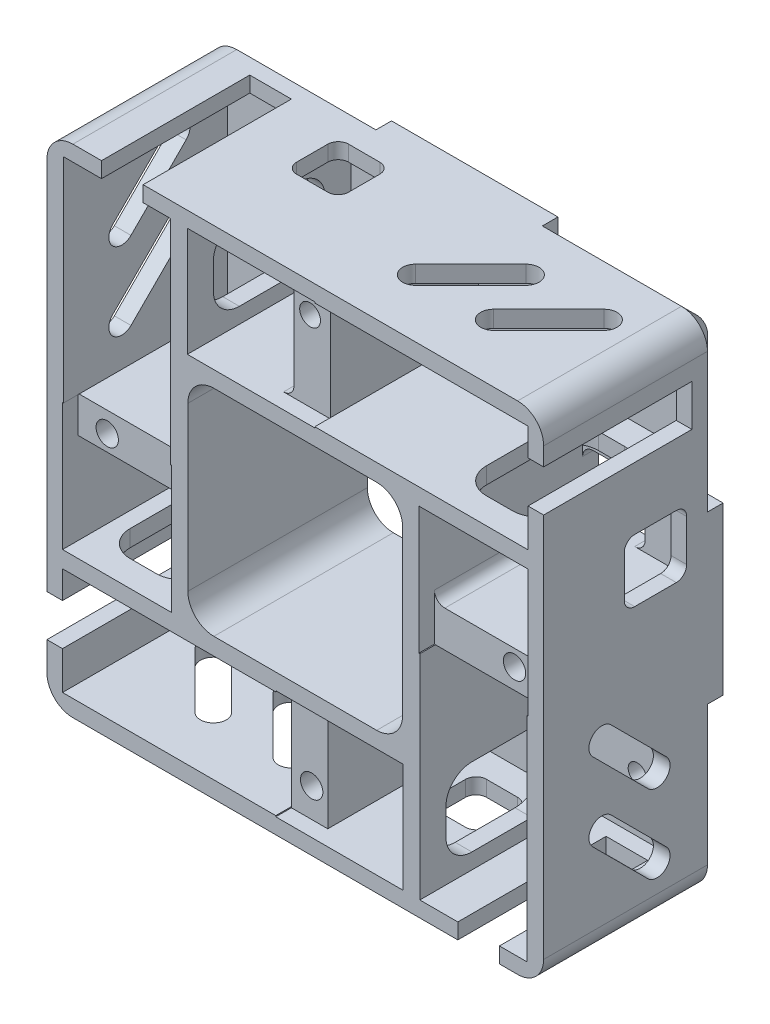
from build123d import *

# Parameters (mm, degrees)
SKETCH_1_W                       = 95.5
SKETCH_1_H                       = 95.5
SKETCH_1_R                       = 1.75
EXTRUDE_1_DEPTH                  = 3
SKETCH_3_W                       = 95.5
SKETCH_3_H                       = 95.5
SKETCH_3_W_2                     = 41
SKETCH_3_H_2                     = 21
SKETCH_3_W_3                     = 21
SKETCH_3_H_3                     = 18.5
SKETCH_3_W_4                     = 18.5
SKETCH_3_H_4                     = 41
EXTRUDE_2_DEPTH                  = 31.5
FILLET_1_R                       = 5
CHAMFER_1_SIZE                   = 3
SKETCH_17_W                      = 32
SKETCH_17_H                      = 3
SKETCH_17_W_2                    = 3
SKETCH_17_H_2                    = 32
EXTRUDE_6_DEPTH                  = 3
SKETCH_19_R                      = 2
CUT_EXTRUDE_4_DEPTH              = 2.8
SKETCH_21_W                      = 21
SKETCH_21_H                      = 6
SKETCH_21_W_2                    = 6
SKETCH_21_H_2                    = 21
CUT_EXTRUDE_6_DEPTH              = 3
SKETCH_34_W                      = 28.5
SKETCH_34_H                      = 21
EXTRUDE_8_DEPTH                  = 1
SKETCH_35_W                      = 21
SKETCH_35_H                      = 28.5
EXTRUDE_9_DEPTH                  = 1
SKETCH_36_W                      = 28.5
SKETCH_36_H                      = 21
EXTRUDE_10_DEPTH                 = 1
SKETCH_37_W                      = 21
SKETCH_37_H                      = 28.5
EXTRUDE_11_DEPTH                 = 1
SKETCH_20_R                      = 2.15
SKETCH_20_R_2                    = 2
CUT_EXTRUDE_5_DEPTH              = 5
CUT_EXTRUDE_START                = 3
SKETCH_23_W                      = 8
SKETCH_23_H                      = 3
SKETCH_23_W_2                    = 3
SKETCH_23_H_2                    = 8
CUT_EXTRUDE_8_DEPTH              = 72.51426038
SKETCH_24_W                      = 10
SKETCH_24_H                      = 10
CUT_EXTRUDE_9_DEPTH              = 10
SKETCH_25_W                      = 12
SKETCH_25_H                      = 12
CUT_EXTRUDE_10_DEPTH             = 10
SKETCH_26_W                      = 10
SKETCH_26_H                      = 10
CUT_EXTRUDE_11_DEPTH             = 10
SKETCH_27_W                      = 10
SKETCH_27_H                      = 10
CUT_EXTRUDE_12_DEPTH             = 10
CUT_EXTRUDE_13_DEPTH             = 75.51426038
CUT_EXTRUDE_13_DEPTH_BACK        = 75.51426038
SKETCH_28_W                      = 12
SKETCH_28_H                      = 12
FILLET_2_R                       = 2
FILLET_3_R                       = 2
SKETCH_38_W                      = 0.2
SKETCH_38_H                      = 41
SKETCH_38_W_2                    = 41
SKETCH_38_H_2                    = 0.2
EXTRUDE_12_DEPTH                 = 31.5
SKETCH_40_W                      = 41.5
SKETCH_40_H                      = 41.5
EXTRUDE_13_DEPTH                 = 31.5
SKETCH_39_W                      = 41.3
SKETCH_39_H                      = 41.3
CUT_EXTRUDE_14_DEPTH             = 76.831227077
FILLET_4_R                       = 5
CUT_EXTRUDE_15_DEPTH             = 10
PATTERN_CIRCULAR_1_COUNT         = 4
SKETCH_45_W                      = 21.5
SKETCH_45_H                      = 15
CUT_EXTRUDE_16_DEPTH             = 10
FILLET_5_R                       = 5
PATTERN_CIRCULAR_2_COUNT         = 4
FILLET_5_OF_PATTERN_CIRCULAR_2_R = 5


with BuildPart() as part:
    # ｽｹｯﾁ1 → ﾎﾞｽ - 押し出し1 (new body)
    with BuildSketch(Plane.XY):
        Rectangle(SKETCH_1_W, SKETCH_1_H)
        with Locations((34.25, 34.25)):
            Circle(SKETCH_1_R, mode=Mode.SUBTRACT)
        with Locations((-34.25, 34.25)):
            Circle(SKETCH_1_R, mode=Mode.SUBTRACT)
        with Locations((-34.25, -34.25)):
            Circle(SKETCH_1_R, mode=Mode.SUBTRACT)
        with Locations((34.25, -34.25)):
            Circle(SKETCH_1_R, mode=Mode.SUBTRACT)
    extrude(amount=EXTRUDE_1_DEPTH)

    # ｽｹｯﾁ3 → ﾎﾞｽ - 押し出し2 (add)
    with BuildSketch(Plane.XY.offset(3)):
        Rectangle(SKETCH_3_W, SKETCH_3_H)
        with Locations((-24.25, -34.25)):
            Rectangle(SKETCH_3_W_2, SKETCH_3_H_2, mode=Mode.SUBTRACT)
        with Locations((-34.25, -11.5)):
            Rectangle(SKETCH_3_W_3, SKETCH_3_H_3, mode=Mode.SUBTRACT)
        with Locations((11.5, -34.25)):
            Rectangle(SKETCH_3_W_4, SKETCH_3_H_2, mode=Mode.SUBTRACT)
        with Locations((34.25, -24.25)):
            Rectangle(SKETCH_3_W_3, SKETCH_3_H_4, mode=Mode.SUBTRACT)
        with Locations((-34.25, 24.25)):
            Rectangle(SKETCH_3_W_3, SKETCH_3_H_4, mode=Mode.SUBTRACT)
        with Locations((-11.5, 34.25)):
            Rectangle(SKETCH_3_W_4, SKETCH_3_H_2, mode=Mode.SUBTRACT)
        Polygon((20.75, -20.75), (2.25, -20.75), (-20.75, -20.75), (-20.75, -2), (-20.75, 20.75), (-2, 20.75), (20.75, 20.75), (20.75, 2), align=None, mode=Mode.SUBTRACT)
        with Locations((34.25, 11.5)):
            Rectangle(SKETCH_3_W_3, SKETCH_3_H_3, mode=Mode.SUBTRACT)
        with Locations((24.25, 34.25)):
            Rectangle(SKETCH_3_W_2, SKETCH_3_H_2, mode=Mode.SUBTRACT)
    extrude(amount=EXTRUDE_2_DEPTH)

    # ﾌｨﾚｯﾄ1
    fillet_1_edges = [part.edges().sort_by_distance(p)[0] for p in [
        (-47.75, 47.75, 17.25),
        (47.75, 47.75, 17.25),
        (47.75, -47.75, 17.25),
        (-47.75, -47.75, 17.25),
    ]]
    fillet(fillet_1_edges, radius=FILLET_1_R)

    # 面取り1
    chamfer_1_edges = [part.edges().sort_by_distance(p)[0] for p in [
        (0, -47.75, 0),
        (-47.75, 0, 0),
        (0, 47.75, 0),
        (47.75, 0, 0),
        (-46.285533906, 46.285533906, 0),
        (46.285533906, 46.285533906, 0),
        (46.285533906, -46.285533906, 0),
        (-46.285533906, -46.285533906, 0),
    ]]
    chamfer(chamfer_1_edges, length=CHAMFER_1_SIZE)

    # ｽｹｯﾁ17 → ﾎﾞｽ - 押し出し6 (add)
    with BuildSketch(Plane(origin=(0, 0, 0), x_dir=(-1, 0, 0), z_dir=(0, 0, -1))):
        with Locations((0, 46.25)):
            Rectangle(SKETCH_17_W, SKETCH_17_H)
        with Locations((46.25, 0)):
            Rectangle(SKETCH_17_W_2, SKETCH_17_H_2)
        with Locations((0, -46.25)):
            Rectangle(SKETCH_17_W, SKETCH_17_H)
        with Locations((-46.25, 0)):
            Rectangle(SKETCH_17_W_2, SKETCH_17_H_2)
    extrude(amount=-EXTRUDE_6_DEPTH)

    # ｽｹｯﾁ19 → ｶｯﾄ - 押し出し4 (cut)
    with BuildSketch(Plane(origin=(0, 0, 0), x_dir=(-1, 0, 0), z_dir=(0, 0, -1))):
        with Locations((0, 37.75)):
            Circle(SKETCH_19_R)
        with Locations((-37.75, 0)):
            Circle(SKETCH_19_R)
        with Locations((37.75, 0)):
            Circle(SKETCH_19_R)
        with Locations((0, -37.75)):
            Circle(SKETCH_19_R)
    extrude(amount=-CUT_EXTRUDE_4_DEPTH, mode=Mode.SUBTRACT)

    # ｽｹｯﾁ21 → ｶｯﾄ - 押し出し6 (cut)
    with BuildSketch(Plane.XY.offset(34.5)):
        with Locations((34.25, -0.75)):
            Rectangle(SKETCH_21_W, SKETCH_21_H)
        with Locations((-0.75, -34.25)):
            Rectangle(SKETCH_21_W_2, SKETCH_21_H_2)
        with Locations((-34.25, 0.75)):
            Rectangle(SKETCH_21_W, SKETCH_21_H)
        with Locations((0.75, 34.25)):
            Rectangle(SKETCH_21_W_2, SKETCH_21_H_2)
    extrude(amount=-CUT_EXTRUDE_6_DEPTH, mode=Mode.SUBTRACT)

    # ｽｹｯﾁ34 → ﾎﾞｽ - 押し出し8 (add)
    with BuildSketch(Plane(origin=(2.25, 0, 0), x_dir=(0, 0, -1), z_dir=(1, 0, 0))):
        with Locations((-17.25, -34.25)):
            Rectangle(SKETCH_34_W, SKETCH_34_H)
    extrude(amount=EXTRUDE_8_DEPTH)

    # ｽｹｯﾁ35 → ﾎﾞｽ - 押し出し9 (add)
    with BuildSketch(Plane(origin=(0, -2.25, 0), x_dir=(-1, 0, 0), z_dir=(0, -1, 0))):
        with Locations((34.25, -17.25)):
            Rectangle(SKETCH_35_W, SKETCH_35_H)
    extrude(amount=EXTRUDE_9_DEPTH)

    # ｽｹｯﾁ36 → ﾎﾞｽ - 押し出し10 (add)
    with BuildSketch(Plane.ZY.offset(2.25)):
        with Locations((17.25, 34.25)):
            Rectangle(SKETCH_36_W, SKETCH_36_H)
    extrude(amount=EXTRUDE_10_DEPTH)

    # ｽｹｯﾁ37 → ﾎﾞｽ - 押し出し11 (add)
    with BuildSketch(Plane(origin=(0, 2.25, 0), x_dir=(1, 0, 0), z_dir=(0, 1, 0))):
        with Locations((34.25, -17.25)):
            Rectangle(SKETCH_37_W, SKETCH_37_H)
    extrude(amount=EXTRUDE_11_DEPTH)

    # ｽｹｯﾁ20 → ｶｯﾄ - 押し出し5 (cut)
    with BuildSketch(Plane.XY.offset(31.5)):
        with Locations((-39.15, -0.15)):
            Circle(SKETCH_20_R)
        with Locations((-0.15, 39.15)):
            Circle(SKETCH_20_R_2)
        with Locations((39.15, 0.15)):
            Circle(SKETCH_20_R)
        with Locations((0.15, -39.15)):
            Circle(SKETCH_20_R)
    extrude(amount=-CUT_EXTRUDE_5_DEPTH, mode=Mode.SUBTRACT)

    # ｽｹｯﾁ23 → ｶｯﾄ - 押し出し8 (cut, through all)
    with BuildSketch(Plane.XY.offset(3).offset(CUT_EXTRUDE_START)):
        with Locations((-33.25, 46.25)):
            Rectangle(SKETCH_23_W, SKETCH_23_H)
        with Locations((46.25, 35.25)):
            Rectangle(SKETCH_23_W_2, SKETCH_23_H_2)
        with Locations((35.25, -46.25)):
            Rectangle(SKETCH_23_W, SKETCH_23_H)
        with Locations((-46.25, -33.25)):
            Rectangle(SKETCH_23_W_2, SKETCH_23_H_2)
    extrude(amount=CUT_EXTRUDE_8_DEPTH, mode=Mode.SUBTRACT)

    # ｽｹｯﾁ24 → ｶｯﾄ - 押し出し9 (cut)
    with BuildSketch(Plane(origin=(0, 47.75, 0), x_dir=(1, 0, 0), z_dir=(0, 1, 0))):
        with Locations((-13.25, -13)):
            Rectangle(SKETCH_24_W, SKETCH_24_H)
    extrude(amount=-CUT_EXTRUDE_9_DEPTH, mode=Mode.SUBTRACT)

    # ｽｹｯﾁ25 → ｶｯﾄ - 押し出し10 (cut)
    with BuildSketch(Plane(origin=(47.75, 0, 0), x_dir=(0, 0, -1), z_dir=(1, 0, 0))):
        with Locations((-13, 13.25)):
            Rectangle(SKETCH_25_W, SKETCH_25_H)
    extrude(amount=-CUT_EXTRUDE_10_DEPTH, mode=Mode.SUBTRACT)

    # ｽｹｯﾁ26 → ｶｯﾄ - 押し出し11 (cut)
    with BuildSketch(Plane(origin=(0, -47.75, 0), x_dir=(-1, 0, 0), z_dir=(0, -1, 0))):
        with Locations((-13.25, -13)):
            Rectangle(SKETCH_26_W, SKETCH_26_H)
    extrude(amount=-CUT_EXTRUDE_11_DEPTH, mode=Mode.SUBTRACT)

    # ｽｹｯﾁ27 → ｶｯﾄ - 押し出し12 (cut)
    with BuildSketch(Plane.ZY.offset(47.75)):
        with Locations((13, -11.25)):
            Rectangle(SKETCH_27_W, SKETCH_27_H)
    extrude(amount=-CUT_EXTRUDE_12_DEPTH, mode=Mode.SUBTRACT)

    # ｽｹｯﾁ28 → ｶｯﾄ - 押し出し13 (cut, two sides: drawn at the far end of the back side and taken through both)
    with BuildSketch(Plane.XY.offset(3).offset(-CUT_EXTRUDE_13_DEPTH_BACK)):
        with Locations((29.75, 9.25)):
            Rectangle(SKETCH_28_W, SKETCH_28_H)
        with Locations((-9.25, 29.75)):
            Rectangle(SKETCH_28_W, SKETCH_28_H)
        with Locations((-29.75, -9.25)):
            Rectangle(SKETCH_28_W, SKETCH_28_H)
        with Locations((9.25, -29.75)):
            Rectangle(SKETCH_28_W, SKETCH_28_H)
    extrude(amount=CUT_EXTRUDE_13_DEPTH + CUT_EXTRUDE_13_DEPTH_BACK, mode=Mode.SUBTRACT)

    # ﾌｨﾚｯﾄ2
    fillet_2_edges = [part.edges().sort_by_distance(p)[0] for p in [
        (3.25, -23.75, 15.75),
        (-23.75, -3.25, 15.75),
        (-3.25, 23.75, 15.75),
        (23.75, 3.25, 15.75),
        (35.75, 15.25, 1.5),
        (35.75, 3.25, 1.5),
        (23.75, 15.25, 1.5),
        (-3.25, 35.75, 1.5),
        (-15.25, 23.75, 1.5),
        (-15.25, 35.75, 1.5),
        (-35.75, -15.25, 1.5),
        (-35.75, -3.25, 1.5),
        (-23.75, -15.25, 1.5),
        (3.25, -35.75, 1.5),
        (15.25, -23.75, 1.5),
        (15.25, -35.75, 1.5),
    ]]
    fillet(fillet_2_edges, radius=FILLET_2_R)

    # ﾌｨﾚｯﾄ3
    fillet_3_edges = [part.edges().sort_by_distance(p)[0] for p in [
        (-8.25, 46.25, 8),
        (-8.25, 46.25, 18),
        (-18.25, 46.25, 18),
        (-18.25, 46.25, 8),
        (46.25, 7.25, 19),
        (46.25, 19.25, 19),
        (46.25, 19.25, 7),
        (46.25, 7.25, 7),
        (18.25, -46.25, 18),
        (18.25, -46.25, 8),
        (8.25, -46.25, 8),
        (8.25, -46.25, 18),
        (-46.25, -6.25, 18),
        (-46.25, -16.25, 18),
        (-46.25, -16.25, 8),
        (-46.25, -6.25, 8),
    ]]
    fillet(fillet_3_edges, radius=FILLET_3_R)

    # ｽｹｯﾁ38 → ﾎﾞｽ - 押し出し12 (add)
    with BuildSketch(Plane.XY.offset(34.5)):
        with Locations((44.65, -24.25)):
            Rectangle(SKETCH_38_W, SKETCH_38_H)
        with Locations((23.85, -24.25)):
            Rectangle(SKETCH_38_W, SKETCH_38_H)
        with Locations((-24.25, -44.65)):
            Rectangle(SKETCH_38_W_2, SKETCH_38_H_2)
        with Locations((-24.25, -23.85)):
            Rectangle(SKETCH_38_W_2, SKETCH_38_H_2)
        with Locations((-44.65, 24.25)):
            Rectangle(SKETCH_38_W, SKETCH_38_H)
        with Locations((-23.85, 24.25)):
            Rectangle(SKETCH_38_W, SKETCH_38_H)
        with Locations((24.25, 23.85)):
            Rectangle(SKETCH_38_W_2, SKETCH_38_H_2)
        with Locations((24.25, 44.65)):
            Rectangle(SKETCH_38_W_2, SKETCH_38_H_2)
    extrude(amount=-EXTRUDE_12_DEPTH)

    # ｽｹｯﾁ40 → ﾎﾞｽ - 押し出し13 (add, through all)
    with BuildSketch(Plane.XY.offset(3)):
        Rectangle(SKETCH_40_W, SKETCH_40_H)
    extrude(amount=EXTRUDE_13_DEPTH)

    # ｽｹｯﾁ39 → ｶｯﾄ - 押し出し14 (cut, through all)
    with BuildSketch(Plane(origin=(0, 0, 0), x_dir=(-1, 0, 0), z_dir=(0, 0, -1))):
        Rectangle(SKETCH_39_W, SKETCH_39_H)
    extrude(amount=-CUT_EXTRUDE_14_DEPTH, mode=Mode.SUBTRACT)

    # ﾌｨﾚｯﾄ4
    fillet_4_edges = [part.edges().sort_by_distance(p)[0] for p in [
        (20.65, -20.65, 17.25),
        (20.65, 20.65, 17.25),
        (-20.65, 20.65, 17.25),
        (-20.65, -20.65, 17.25),
    ]]
    fillet(fillet_4_edges, radius=FILLET_4_R)

    # ｽｹｯﾁ41 → ｶｯﾄ - 押し出し15 (cut)
    with BuildSketch(Plane.ZY.offset(47.75)):
        with BuildLine():
            Line((14.464466094, 24.321067812), (25.071067812, 13.714466094))
            ThreePointArc((25.071067812, 13.714466094), (25.071067812, 10.178932188), (21.535533906, 10.178932188))
            Line((21.535533906, 10.178932188), (10.928932188, 20.785533906))
            ThreePointArc((10.928932188, 20.785533906), (10.928932188, 24.321067812), (14.464466094, 24.321067812))
        make_face()
        with BuildLine():
            Line((21.535533906, 25.178932188), (10.928932188, 35.785533906))
            ThreePointArc((10.928932188, 35.785533906), (10.928932188, 39.321067812), (14.464466094, 39.321067812))
            Line((14.464466094, 39.321067812), (25.071067812, 28.714466094))
            ThreePointArc((25.071067812, 28.714466094), (25.071067812, 25.178932188), (21.535533906, 25.178932188))
        make_face()
    cut_extrude_15 = extrude(amount=-CUT_EXTRUDE_15_DEPTH, mode=Mode.SUBTRACT)

    # 円形ﾊﾟﾀｰﾝ1: ｶｯﾄ - 押し出し15 ×4 about axis
    pattern_circular_1_axis = Axis((0, 0, 0), (0, 0, 1))
    for i in range(1, PATTERN_CIRCULAR_1_COUNT):
        add(cut_extrude_15.rotate(pattern_circular_1_axis, i * 360 / PATTERN_CIRCULAR_1_COUNT), mode=Mode.SUBTRACT)

    # ｽｹｯﾁ45 → ｶｯﾄ - 押し出し16 (cut)
    with BuildSketch(Plane(origin=(-20.75, 0, 0), x_dir=(0, 0, -1), z_dir=(1, 0, 0))):
        with Locations((-18.75, 34.25)):
            Rectangle(SKETCH_45_W, SKETCH_45_H)
    cut_extrude_16 = extrude(amount=-CUT_EXTRUDE_16_DEPTH, mode=Mode.SUBTRACT)

    # ﾌｨﾚｯﾄ5
    fillet_5_edges = [part.edges().sort_by_distance(p)[0] for p in [
        (-22.35, 26.75, 29.5),
        (-22.35, 41.75, 29.5),
        (-22.35, 41.75, 8),
        (-22.35, 26.75, 8),
    ]]
    fillet(fillet_5_edges, radius=FILLET_5_R)

    # 円形ﾊﾟﾀｰﾝ2: ｶｯﾄ - 押し出し16 ×4 about axis
    pattern_circular_2_axis = Axis((0, 0, 0), (0, 0, 1))
    for i in range(1, PATTERN_CIRCULAR_2_COUNT):
        add(cut_extrude_16.rotate(pattern_circular_2_axis, i * 360 / PATTERN_CIRCULAR_2_COUNT), mode=Mode.SUBTRACT)

    # ﾌｨﾚｯﾄ5 of 円形ﾊﾟﾀｰﾝ2
    fillet_5_of_pattern_circular_2_edges = [part.edges().sort_by_distance(p)[0] for p in [
        (-26.75, -22.35, 29.5),
        (-41.75, -22.35, 29.5),
        (-41.75, -22.35, 8),
        (-26.75, -22.35, 8),
        (22.35, -26.75, 29.5),
        (22.35, -41.75, 29.5),
        (22.35, -41.75, 8),
        (22.35, -26.75, 8),
        (26.75, 22.35, 29.5),
        (41.75, 22.35, 29.5),
        (41.75, 22.35, 8),
        (26.75, 22.35, 8),
    ]]
    fillet(fillet_5_of_pattern_circular_2_edges, radius=FILLET_5_OF_PATTERN_CIRCULAR_2_R)


solid = part.part
